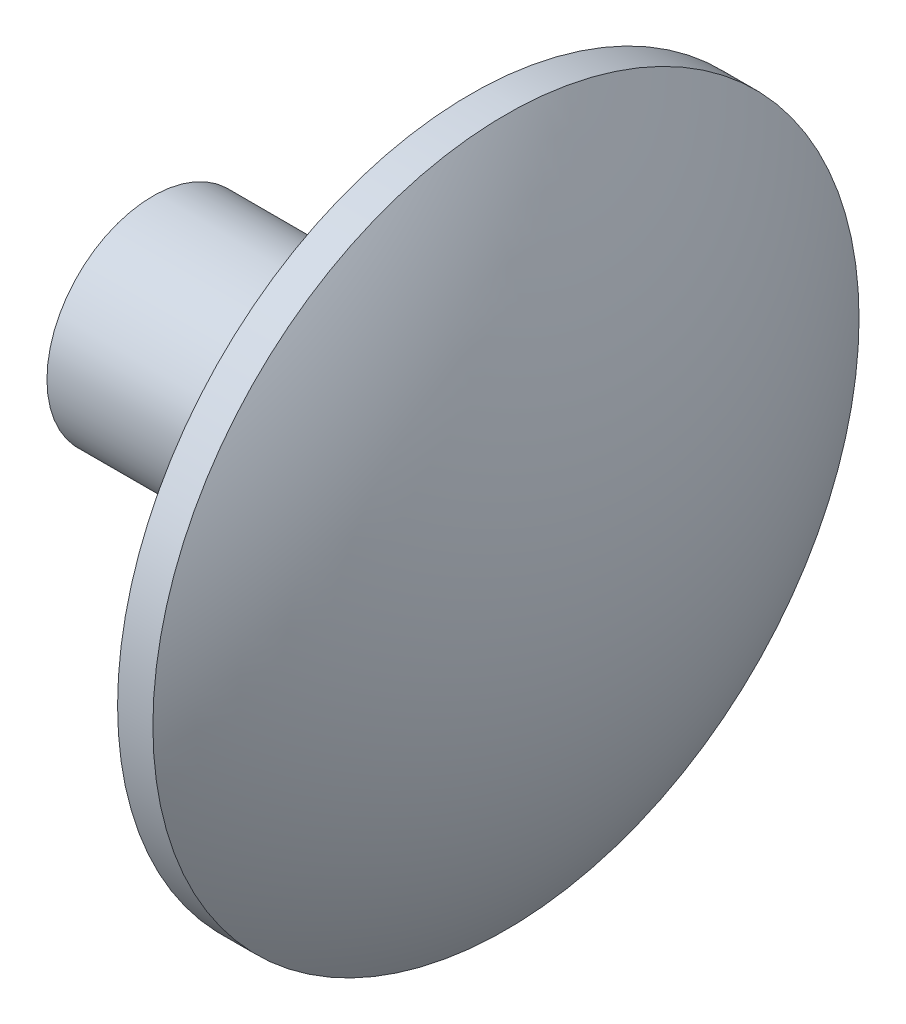
from build123d import *

# Parameters (mm, degrees)
SKETCH1_R             = 10
BOSS_EXTRUDE1_DEPTH   = 1
SKETCH3_W             = 6
SKETCH3_H             = 6
BOSS_EXTRUDE2_DEPTH   = 2
SKETCH4_R             = 3
BOSS_EXTRUDE3_DEPTH   = 7
M5_TAPPED_HOLE1_D     = 4.2
M5_TAPPED_HOLE1_DEPTH = 7
M5_TAPPED_HOLE1_TIP   = 1.2618073


with BuildPart() as part:
    # Sketch1 → Boss-Extrude1 (new body)
    with BuildSketch(Plane(origin=(0, 0, 0), x_dir=(0, 0, -1), z_dir=(1, 0, 0))):
        Circle(SKETCH1_R)
    extrude(amount=BOSS_EXTRUDE1_DEPTH)

    # Sketch2 → Revolve1 (revolve)
    with BuildSketch(Plane(origin=(0, 0, 0), x_dir=(1, 0, 0), z_dir=(0, 1, 0))):
        with BuildLine():
            Line((1, 0), (4, 0))
            ThreePointArc((4, 0), (3.233844182, 5.220153254), (1, 10))
            Line((1, 10), (1, 0))
        make_face()
    revolve(axis=Axis((1, 0, 0), (1, 0, 0)))

    # Sketch3 → Boss-Extrude2 (add)
    with BuildSketch(Plane.ZY):
        Rectangle(SKETCH3_W, SKETCH3_H)
    extrude(amount=BOSS_EXTRUDE2_DEPTH)

    # Sketch4 → Boss-Extrude3 (add)
    with BuildSketch(Plane.ZY.offset(2)):
        Circle(SKETCH4_R)
    extrude(amount=BOSS_EXTRUDE3_DEPTH)

    # M5 Tapped Hole1
    with Locations(Plane.ZY.offset(9)):
        with Locations((0, 0)):
            Hole(M5_TAPPED_HOLE1_D / 2, depth=M5_TAPPED_HOLE1_DEPTH)
            with Locations((0, 0, -(M5_TAPPED_HOLE1_DEPTH + M5_TAPPED_HOLE1_TIP / 2))):  # 118° drill point
                Cone(0, M5_TAPPED_HOLE1_D / 2, M5_TAPPED_HOLE1_TIP, mode=Mode.SUBTRACT)


solid = part.part
